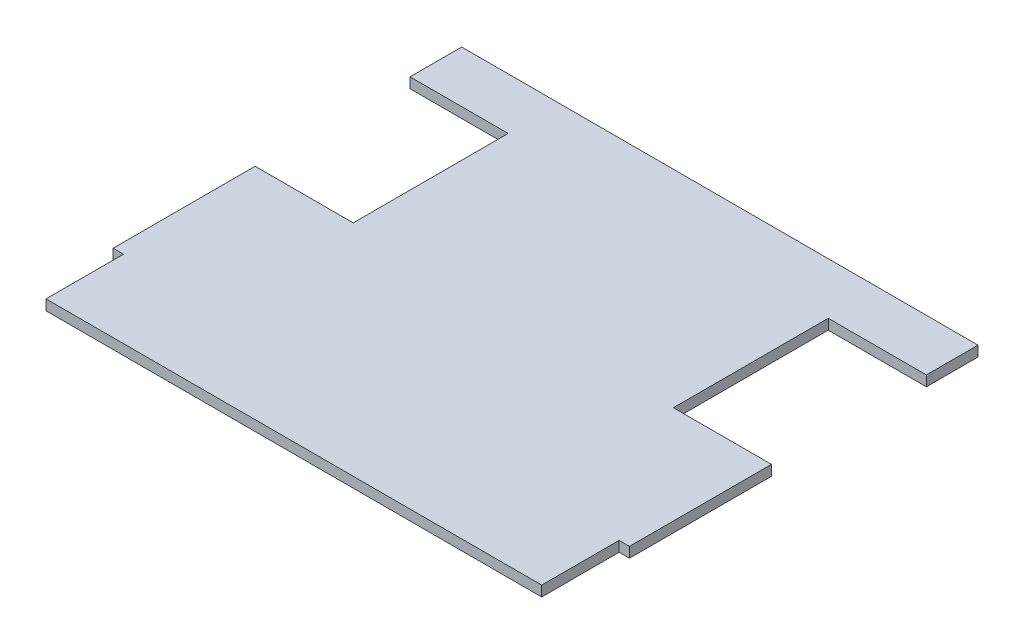
from build123d import *

# Parameters (mm, degrees)
SALIENTE_EXTRUIR1_DEPTH = 4
CORTAR_EXTRUIR1_REACH   = 131.701
CROQUIS4_W              = 4
CROQUIS4_H              = 30


with BuildPart() as part:
    # Croquis3 → Saliente-Extruir1 (new body)
    with BuildSketch(Plane(origin=(0, 0, 0), x_dir=(1, 0, 0), z_dir=(0, 1, 0))):
        Polygon((100, 82.5), (-100, 82.5), (-100, 62.5), (-62, 62.5), (-62, 2.5), (-100, 2.5), (-100, -82.5), (100, -82.5), (100, 2.5), (62, 2.5), (62, 62.5), (100, 62.5), align=None)
    extrude(amount=SALIENTE_EXTRUIR1_DEPTH)

    # Croquis4 → Cortar-Extruir1 (cut, up to next)
    with BuildSketch(Plane(origin=(0, 4, 0), x_dir=(1, 0, 0), z_dir=(0, 1, 0)), mode=Mode.PRIVATE) as cortar_extruir1_sk1:
        with Locations((98, -67.5)):
            Rectangle(CROQUIS4_W, CROQUIS4_H)
    cortar_extruir1_tool1 = extrude(cortar_extruir1_sk1.sketch, amount=-CORTAR_EXTRUIR1_REACH, mode=Mode.PRIVATE) & part.part
    # Croquis4 → Cortar-Extruir1 (cut, up to next)
    with BuildSketch(Plane(origin=(0, 4, 0), x_dir=(1, 0, 0), z_dir=(0, 1, 0)), mode=Mode.PRIVATE) as cortar_extruir1_sk2:
        with Locations((-98, -67.5)):
            Rectangle(CROQUIS4_W, CROQUIS4_H)
    cortar_extruir1_tool2 = extrude(cortar_extruir1_sk2.sketch, amount=-CORTAR_EXTRUIR1_REACH, mode=Mode.PRIVATE) & part.part
    add(cortar_extruir1_tool1.solids().sort_by_distance((98, 4, 67.5))[0], mode=Mode.SUBTRACT)
    add(cortar_extruir1_tool2.solids().sort_by_distance((-98, 4, 67.5))[0], mode=Mode.SUBTRACT)


solid = part.part
